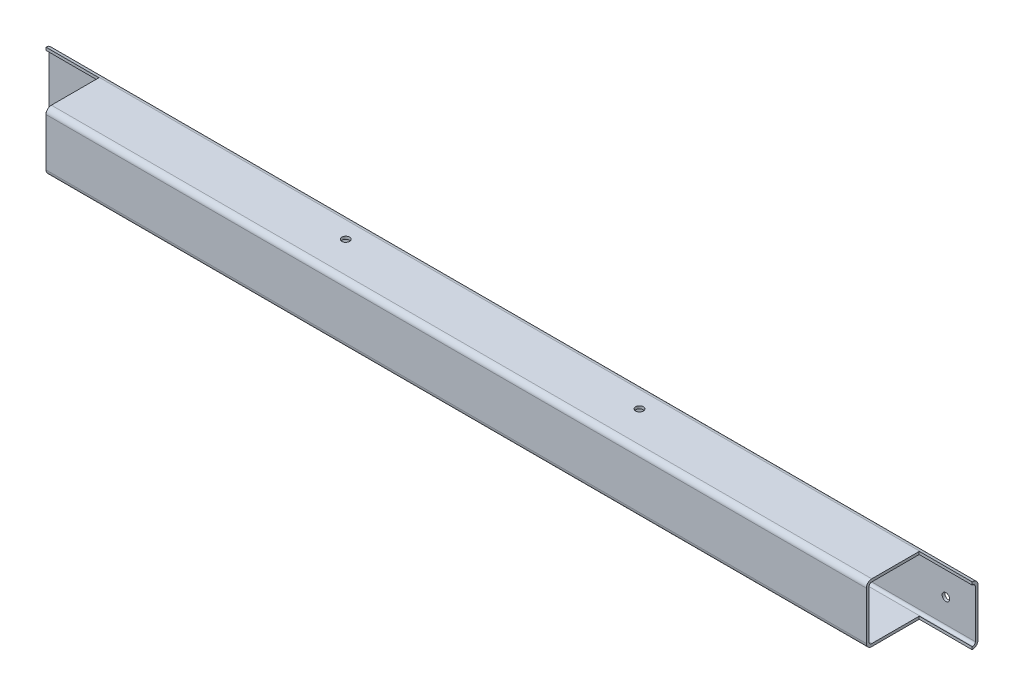
from build123d import *

# Parameters (mm, degrees)
SHS_C450_AS_50X50X2_3_SHS_C450_1_DEPTH = 788
CUT_EXTRUDE1_DEPTH                     = 396.583113896
CUT_EXTRUDE1_DEPTH_BACK                = 396.583113896
SKETCH20_W                             = 45
SKETCH20_H                             = 45
SKETCH21_R                             = 3.25
CUT_EXTRUDE2_DEPTH                     = 10
SKETCH22_R                             = 3.25
CUT_EXTRUDE3_DEPTH                     = 10
SKETCH23_R                             = 7.5
CUT_EXTRUDE4_DEPTH                     = 10


with BuildPart() as part:
    # Sketch19 → Shs c450 as 50X50X2.3 SHS C450(1) (new body)
    with BuildSketch(Plane.YZ.offset(-394)):
        with BuildLine():
            Line((-20.4, -25), (20.4, -25))
            ThreePointArc((20.4, -25), (23.652691193, -23.652691193), (25, -20.4))
            Line((25, -20.4), (25, 20.4))
            ThreePointArc((25, 20.4), (23.652691193, 23.652691193), (20.4, 25))
            Line((20.4, 25), (-20.4, 25))
            ThreePointArc((-20.4, 25), (-23.652691193, 23.652691193), (-25, 20.4))
            Line((-25, 20.4), (-25, -20.4))
            ThreePointArc((-25, -20.4), (-23.652691193, -23.652691193), (-20.4, -25))
        make_face()
        with BuildLine():
            Line((-20.4, 22.7), (20.4, 22.7))
            ThreePointArc((20.4, 22.7), (22.026345597, 22.026345597), (22.7, 20.4))
            Line((22.7, 20.4), (22.7, -20.4))
            ThreePointArc((22.7, -20.4), (22.026345597, -22.026345597), (20.4, -22.7))
            Line((20.4, -22.7), (-20.4, -22.7))
            ThreePointArc((-20.4, -22.7), (-22.026345597, -22.026345597), (-22.7, -20.4))
            Line((-22.7, -20.4), (-22.7, 20.4))
            ThreePointArc((-22.7, 20.4), (-22.026345597, 22.026345597), (-20.4, 22.7))
        make_face(mode=Mode.SUBTRACT)
    extrude(amount=SHS_C450_AS_50X50X2_3_SHS_C450_1_DEPTH)

    # Sketch20 → Cut-Extrude1 (cut, two sides: drawn at the far end of the back side and taken through both)
    with BuildSketch(Plane(origin=(0, 0, 0), x_dir=(1, 0, 0), z_dir=(0, 1, 0)).offset(-CUT_EXTRUDE1_DEPTH_BACK)):
        with Locations((-371.5, -2.5)):
            Rectangle(SKETCH20_W, SKETCH20_H)
        with Locations((371.5, -2.5)):
            Rectangle(SKETCH20_W, SKETCH20_H)
    extrude(amount=CUT_EXTRUDE1_DEPTH + CUT_EXTRUDE1_DEPTH_BACK, mode=Mode.SUBTRACT)

    # Sketch21 → Cut-Extrude2 (cut)
    with BuildSketch(Plane(origin=(0, 0, -25), x_dir=(-1, 0, 0), z_dir=(0, 0, -1))):
        with Locations((-369, 0)):
            Circle(SKETCH21_R)
        with Locations((369, 0)):
            Circle(SKETCH21_R)
    extrude(amount=-CUT_EXTRUDE2_DEPTH, mode=Mode.SUBTRACT)

    # Sketch22 → Cut-Extrude3 (cut)
    with BuildSketch(Plane(origin=(0, 25, 0), x_dir=(1, 0, 0), z_dir=(0, 1, 0))):
        with Locations(Location((-125, 6, 0), (0, 0, 180))):
            Circle(SKETCH22_R)
        with Locations(Location((125, 6, 0), (0, 0, 180))):
            Circle(SKETCH22_R)
    extrude(amount=-CUT_EXTRUDE3_DEPTH, mode=Mode.SUBTRACT)

    # Sketch23 → Cut-Extrude4 (cut)
    with BuildSketch(Plane.XZ.offset(25)):
        with Locations((-125, -6)):
            Circle(SKETCH23_R)
        with Locations((125, -6)):
            Circle(SKETCH23_R)
    extrude(amount=-CUT_EXTRUDE4_DEPTH, mode=Mode.SUBTRACT)


solid = part.part
